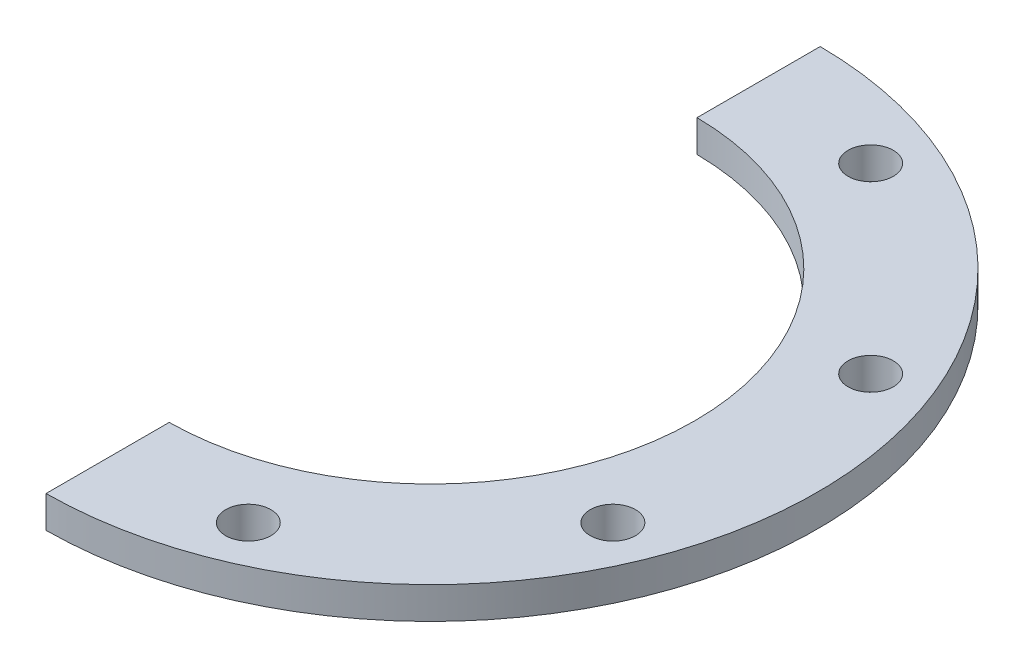
from build123d import *

# Parameters (mm, degrees)
SKETCH2_R           = 2.25
BOSS_EXTRUDE1_DEPTH = 3.175


with BuildPart() as part:
    # Sketch2 → Boss-Extrude1 (new body)
    with BuildSketch(Plane(origin=(0, 87.18, 0), x_dir=(1, 0, 0), z_dir=(0, 1, 0))):
        with BuildLine():
            ThreePointArc((38.5, 0), (27.3118564, 27.135078773), (0.25, 38.499188303))
            Line((0.25, 38.499188303), (0.25, 26.248809497))
            ThreePointArc((0.25, 26.248809497), (18.649731902, 18.472953202), (26.25, 0))
            ThreePointArc((26.25, 0), (18.649731902, -18.472953202), (0.25, -26.248809497))
            Line((0.25, -26.248809497), (0.25, -38.499188303))
            ThreePointArc((0.25, -38.499188303), (27.3118564, -27.135078773), (38.5, 0))
        make_face()
        with Locations(Location((12.819894984, -30.949964339, 0), (0, 0, 270))):
            Circle(SKETCH2_R, mode=Mode.SUBTRACT)
        with Locations(Location((30.949964339, -12.819894984, 0), (0, 0, 270))):
            Circle(SKETCH2_R, mode=Mode.SUBTRACT)
        with Locations(Location((30.949964339, 12.819894984, 0), (0, 0, 270))):
            Circle(SKETCH2_R, mode=Mode.SUBTRACT)
        with Locations(Location((12.819894984, 30.949964339, 0), (0, 0, 270))):
            Circle(SKETCH2_R, mode=Mode.SUBTRACT)
    extrude(amount=-BOSS_EXTRUDE1_DEPTH)


solid = part.part
